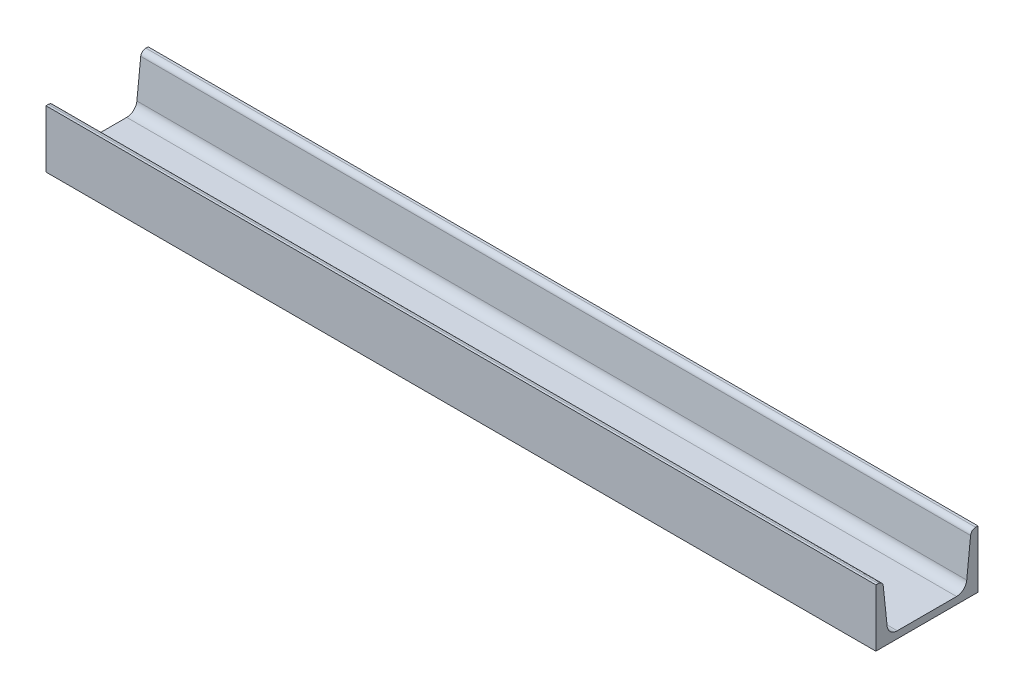
from build123d import *

# Parameters (mm, degrees)
CANAL_C_80_X_8_1_DEPTH = 650


with BuildPart() as part:
    # Sketch15 → Canal c 80 X 8(1) (new body)
    with BuildSketch(Plane.YZ):
        with BuildLine():
            Line((45, 80), (0, 80))
            Line((0, 80), (0, 0))
            Line((0, 0), (45, 0))
            Line((45, 0), (45, 1.822575175))
            ThreePointArc((45, 1.822575175), (43.972579302, 4.499097601), (41.418113853, 5.800662757))
            Line((41.418113853, 5.800662757), (12.663772294, 8.822865837))
            ThreePointArc((12.663772294, 8.822865837), (7.554841396, 11.425996149), (5.5, 16.779041))
            Line((5.5, 16.779041), (5.5, 63.220959))
            ThreePointArc((5.5, 63.220959), (7.554841396, 68.574003851), (12.663772294, 71.177134163))
            Line((12.663772294, 71.177134163), (41.418113853, 74.199337243))
            ThreePointArc((41.418113853, 74.199337243), (43.972579302, 75.500902399), (45, 78.177424825))
            Line((45, 78.177424825), (45, 80))
        make_face()
    extrude(amount=CANAL_C_80_X_8_1_DEPTH)


solid = part.part
